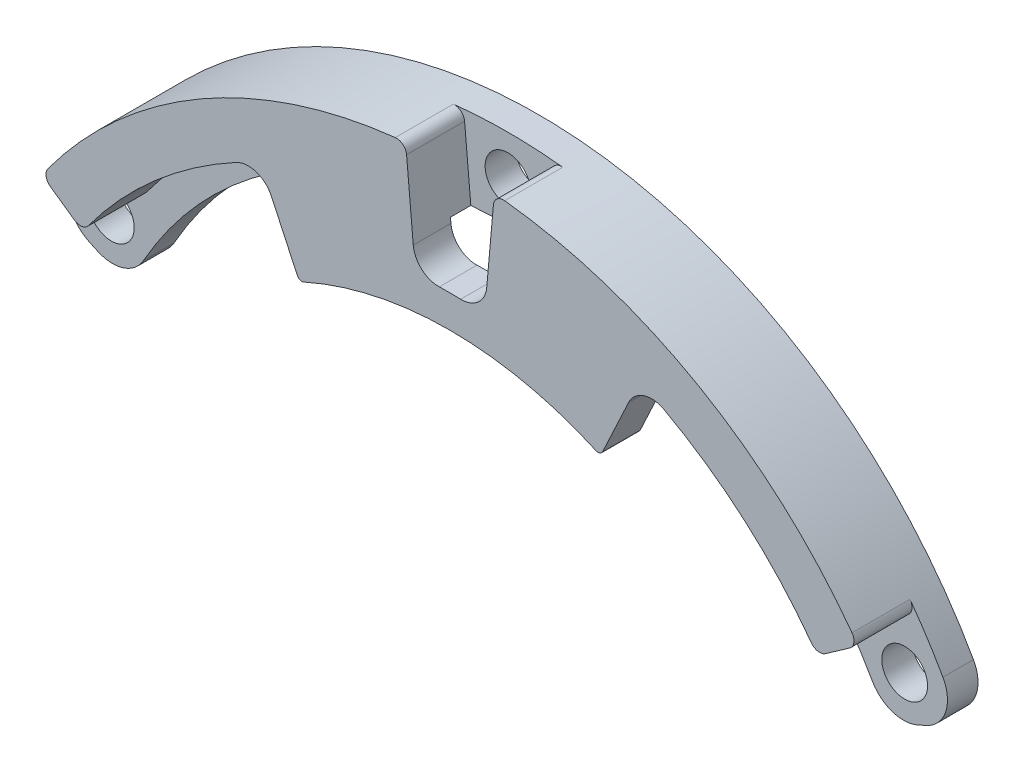
from build123d import *

# Parameters (mm, degrees)
EXTRUDE_1_DEPTH         = 3.699999999999999
EXTRUDE_2_DEPTH         = 2
EXTRUDE_3_DEPTH         = 2
EXTRUDE_4_DEPTH         = 2.9999999999999996
HOLE_WIZARD_4_5_4_5_1_D = 4.5
FILLET_1_R              = 0.5
FILLET_2_R              = 1
FILLET_3_R              = 2.5
FILLET_4_R              = 3.5


with BuildPart() as part:
    # 草图1 → 凸台-拉伸1 (new body)
    with BuildSketch(Plane.XY.offset(8.7)):
        with BuildLine():
            Line((14.79163916092453, 31.720772546282735), (18.637465342764905, 39.96817340831624))
            ThreePointArc((18.637465342764905, 39.96817340831624), (28.317533729903538, 33.807207566668026), (36.080540216984, 25.357535717230103))
            Line((36.080540216984, 25.357535717230103), (40.08948912998223, 28.17503968581122))
            ThreePointArc((40.08948912998223, 28.17503968581122), (24.49999999999949, 42.435244785437796), (4.3555555555549486, 48.80603585421044))
            Line((4.3555555555549486, 48.80603585421044), (3.3935020106793496, 38.025776205131926))
            ThreePointArc((3.3935020106793496, 38.025776205131926), (-2.3395e-13, 38.176897620148004), (-3.3935020106798226, 38.02577620513189))
            Line((-3.3935020106798226, 38.02577620513189), (-4.355555555555555, 48.80603585421038))
            ThreePointArc((-4.355555555555555, 48.80603585421038), (-24.50000000000001, 42.43524478543748), (-40.0894891299826, 28.17503968581074))
            Line((-40.0894891299826, 28.17503968581074), (-36.08054021698431, 25.357535717229652))
            ThreePointArc((-36.08054021698431, 25.357535717229652), (-28.317533729903744, 33.80720756666784), (-18.637465342764894, 39.96817340831625))
            Line((-18.637465342764894, 39.96817340831625), (-14.791639160924516, 31.720772546282742))
            ThreePointArc((-14.791639160924516, 31.720772546282742), (3.21e-15, 35.00000000000001), (14.79163916092453, 31.720772546282735))
        make_face()
    extrude(amount=-EXTRUDE_1_DEPTH)

    # 草图2 → 凸台-拉伸2 (add)
    with BuildSketch(Plane(origin=(0, 0, 5.000000000000001), x_dir=(-1, 0, 0), z_dir=(0, 0, -1))):
        with BuildLine():
            Line((-36.080540216984, 25.357535717230096), (-40.089489129982226, 28.175039685811218))
            ThreePointArc((-40.089489129982226, 28.175039685811218), (-24.499999999998106, 42.435244785438584), (-4.355555555551784, 48.806035854210705))
            Line((-4.355555555551784, 48.806035854210705), (-3.6533333333301714, 40.93730762465429))
            ThreePointArc((-3.6533333333301714, 40.93730762465429), (-10.67199534451459, 39.690282379527844), (-17.3696105575428, 37.249250047206296))
            Line((-17.3696105575428, 37.249250047206296), (-18.63746534276491, 39.96817340831625))
            ThreePointArc((-18.63746534276491, 39.96817340831625), (-28.317533729903555, 33.80720756666802), (-36.080540216984, 25.357535717230096))
        make_face()
    extrude(amount=EXTRUDE_2_DEPTH)

    # 草图3 → 凸台-拉伸3 (add)
    with BuildSketch(Plane(origin=(0, 0, 5.000000000000001), x_dir=(-1, 0, 0), z_dir=(0, 0, -1))):
        with BuildLine():
            Line((3.6533333333333347, 40.937307624654004), (4.355555555555555, 48.80603585421038))
            ThreePointArc((4.355555555555555, 48.80603585421038), (24.500000000000018, 42.43524478543748), (40.089489129982574, 28.175039685810727))
            Line((40.089489129982574, 28.175039685810727), (36.08054021698431, 25.357535717229652))
            ThreePointArc((36.08054021698431, 25.357535717229652), (28.317533729903737, 33.80720756666785), (18.637465342764894, 39.96817340831625))
            Line((18.637465342764894, 39.96817340831625), (17.369610557542792, 37.24925004720629))
            ThreePointArc((17.369610557542792, 37.24925004720629), (10.671995344516127, 39.69028237952743), (3.6533333333333347, 40.937307624654004))
        make_face()
    extrude(amount=EXTRUDE_3_DEPTH)

    # 草图4 → 凸台-拉伸4 (add)
    with BuildSketch(Plane.XY.offset(3)):
        with BuildLine():
            Line((-44.44504468553815, 20.63099616839955), (-37.27941503215546, 17.304774337167785))
            ThreePointArc((-37.27941503215546, 17.304774337167785), (-2.4282e-13, 41.099999999999994), (37.27941503215526, 17.304774337168233))
            Line((37.27941503215526, 17.304774337168233), (44.44504468553791, 20.630996168400085))
            ThreePointArc((44.44504468553791, 20.630996168400085), (-2.897e-13, 49.00000000000001), (-44.44504468553815, 20.63099616839955))
        make_face()
    extrude(amount=-EXTRUDE_4_DEPTH)

    # Ø4.5 (4.5) 直径孔1 (through all)
    with Locations(Plane.XY.offset(3)):
        with Locations((-38.97114317, 22.5), (38.97114317, 22.5), (0, 45)):
            Hole(HOLE_WIZARD_4_5_4_5_1_D / 2)

    # 圆角1
    fillet_1_edges = [part.edges().sort_by_distance(p)[0] for p in [
        (-14.791639160924518, 31.720772546282745, 6.85),
        (14.791639160924529, 31.72077254628274, 6.85),
    ]]
    fillet(fillet_1_edges, radius=FILLET_1_R)

    # 圆角2
    fillet_2_edges = [part.edges().sort_by_distance(p)[0] for p in [
        (-36.08054021698432, 25.357535717229656, 5.85),
        (-40.089489129982596, 28.175039685810734, 5.85),
        (-4.355555555555555, 48.80603585421038, 5.85),
        (4.3555555555533685, 48.80603585421058, 5.85),
        (40.08948912998223, 28.17503968581122, 5.85),
        (36.080540216984, 25.357535717230103, 5.85),
    ]]
    fillet(fillet_2_edges, radius=FILLET_2_R)

    # 圆角3
    fillet_3_edges = [part.edges().sort_by_distance(p)[0] for p in [
        (-18.637465342764898, 39.96817340831625, 5.85),
        (-3.3935020106798235, 38.02577620513189, 6.85),
        (3.3935020106793496, 38.02577620513193, 6.85),
        (18.637465342764905, 39.96817340831625, 5.85),
    ]]
    fillet(fillet_3_edges, radius=FILLET_3_R)

    # 圆角4
    fillet_4_edges = [part.edges().sort_by_distance(p)[0] for p in [
        (-44.44504468553815, 20.630996168399555, 1.5000000000000002),
        (44.44504468553791, 20.630996168400085, 1.5000000000000002),
        (37.27941503215526, 17.30477433716824, 1.5000000000000002),
        (-37.27941503215546, 17.304774337167785, 1.5000000000000002),
    ]]
    fillet(fillet_4_edges, radius=FILLET_4_R)


solid = part.part
